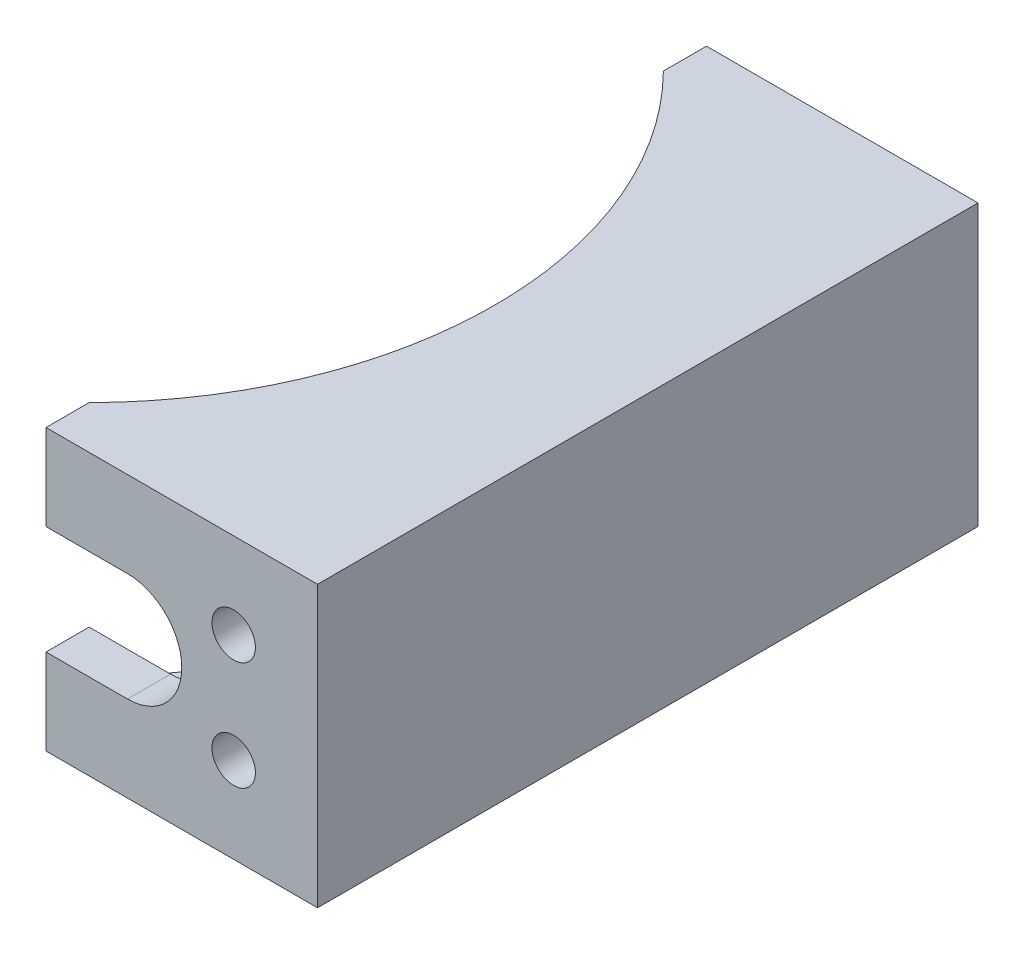
from build123d import *

# Parameters (mm, degrees)
BOSS_EXTRUDE1_DEPTH = 3.175
SKETCH2_W           = 3.175
SKETCH2_H           = 42.3
BOSS_EXTRUDE2_DEPTH = 14.29
SKETCH3_R           = 1.6
BOSS_EXTRUDE3_DEPTH = 3.175


with BuildPart() as part:
    # Sketch1 → Boss-Extrude1 (new body)
    with BuildSketch(Plane(origin=(0, 0, 0), x_dir=(1, 0, 0), z_dir=(0, 1, 0))):
        with BuildLine():
            Line((0, 0), (20, 0))
            Line((20, 0), (20, -42.3))
            Line((20, -42.3), (0, -42.3))
            ThreePointArc((0, -42.3), (8.723780881, -21.15), (0, 0))
        make_face()
    boss_extrude1 = extrude(amount=BOSS_EXTRUDE1_DEPTH)

    # Sketch2 → Boss-Extrude2 (add)
    with BuildSketch(Plane(origin=(0, 3.175, 0), x_dir=(1, 0, 0), z_dir=(0, 1, 0))):
        with Locations((18.4125, -21.15)):
            Rectangle(SKETCH2_W, SKETCH2_H)
    extrude(amount=BOSS_EXTRUDE2_DEPTH)

    # Mirror1: Boss-Extrude1 across plane
    add(boss_extrude1.mirror(Plane.ZX.offset(10.32)))

    # Sketch3 → Boss-Extrude3 (add)
    with BuildSketch(Plane(origin=(0, 0, 0), x_dir=(-1, 0, 0), z_dir=(0, 0, -1))):
        with BuildLine():
            Line((-20, 0), (0, 0))
            Line((0, 0), (0, 6.32))
            Line((0, 6.32), (-6, 6.32))
            ThreePointArc((-6, 6.32), (-10, 10.32), (-6, 14.32))
            Line((-6, 14.32), (0, 14.32))
            Line((0, 14.32), (0, 20.64))
            Line((0, 20.64), (-20, 20.64))
            Line((-20, 20.64), (-20, 0))
        make_face()
        with Locations((-13.825, 6.32)):
            Circle(SKETCH3_R, mode=Mode.SUBTRACT)
        with Locations((-13.825, 14.32)):
            Circle(SKETCH3_R, mode=Mode.SUBTRACT)
    boss_extrude3 = extrude(amount=BOSS_EXTRUDE3_DEPTH)

    # Mirror2: Boss-Extrude3 across plane
    add(boss_extrude3.mirror(Plane.XY.offset(21.15)))


solid = part.part
